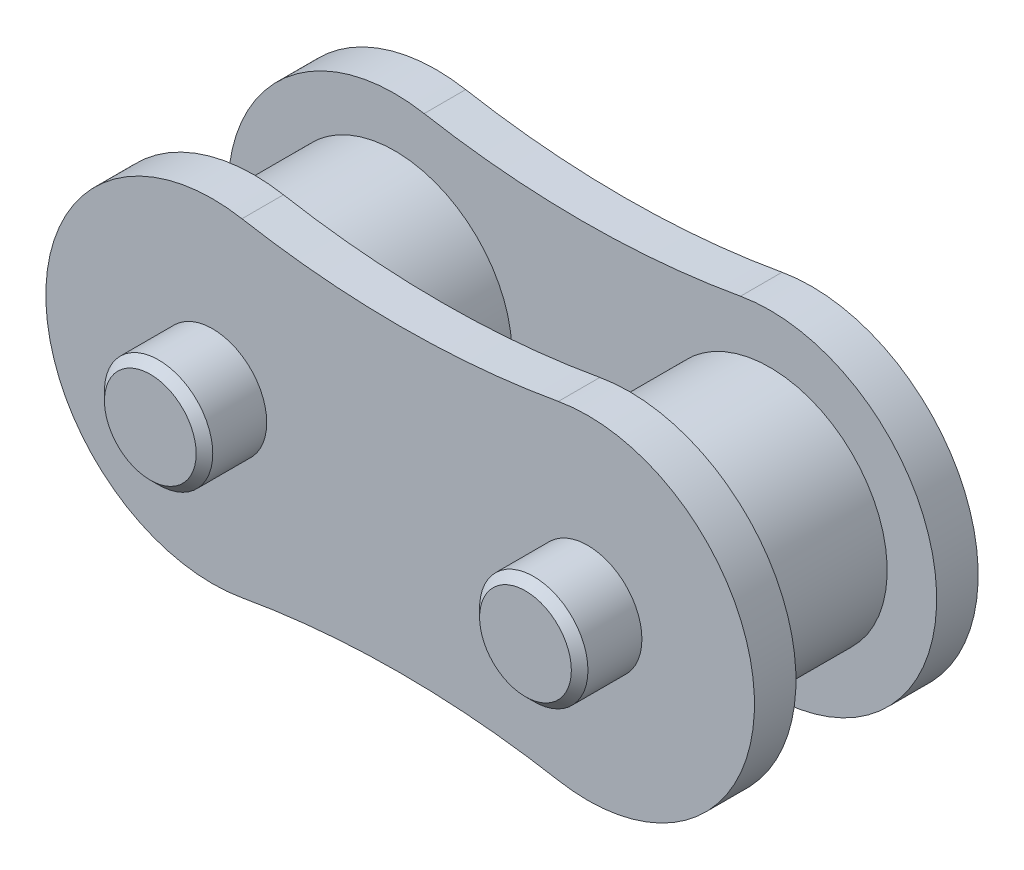
from build123d import *

# Parameters (mm, degrees)
SKETCH_2_R                 = 2.5
EXTRUDE_1_DEPTH            = 1.5
EXTRUDE_1_2_DEPTH          = 1.5
EXTRUDE_2_DEPTH            = 0.885
SKETCH_4_R                 = 1.155
EXTRUDE_3_DEPTH            = 1.3275
CHAMFER_1_SIZE             = 0.177
CHAMFER_1_OF_MIRROR_1_SIZE = 0.177


with BuildPart() as part:
    # 草图2 → 拉伸1 (new, symmetric)
    with BuildSketch(Plane.XY):
        with Locations((4, 0)):
            Circle(SKETCH_2_R)
    extrude(amount=EXTRUDE_1_DEPTH, both=True)



with BuildPart() as body_2:
    # 草图2 → Extrude 1 2 (new, symmetric)
    with BuildSketch(Plane.XY):
        with Locations((-4, 0)):
            Circle(SKETCH_2_R)
    extrude(amount=EXTRUDE_1_2_DEPTH, both=True)


with BuildPart() as part_1:
    add(part.part)

    add(body_2.part)  # 拉伸2 merges body 2
    # 草图3 → 拉伸2 (add)
    with BuildSketch(Plane.XY.offset(1.5)):
        with BuildLine():
            ThreePointArc((-3.373050874, 3.499279896), (-7.555, 0), (-3.373050874, -3.499279896))
            ThreePointArc((-3.373050874, -3.499279896), (0, -3.1995), (3.373050874, -3.499279896))
            ThreePointArc((3.373050874, -3.499279896), (7.555, 0), (3.373050874, 3.499279896))
            ThreePointArc((3.373050874, 3.499279896), (0, 3.1995), (-3.373050874, 3.499279896))
        make_face()
    extrude_2 = extrude(amount=EXTRUDE_2_DEPTH)

    # 草图4 → 拉伸3 (add)
    with BuildSketch(Plane.XY.offset(2.385)):
        with Locations((4, 0)):
            Circle(SKETCH_4_R)
        with Locations((-4, 0)):
            Circle(SKETCH_4_R)
    extrude_3 = extrude(amount=EXTRUDE_3_DEPTH)

    # 倒角1
    chamfer_1_edges = [part_1.edges().sort_by_distance(p)[0] for p in [
        (2.845, 0, 3.7125),
        (-5.155, 0, 3.7125),
    ]]
    chamfer(chamfer_1_edges, length=CHAMFER_1_SIZE)

    # 镜向1: 拉伸2, 拉伸3 across plane
    add(extrude_2.mirror(Plane.XY))
    add(extrude_3.mirror(Plane.XY))

    # 倒角1 of 镜向1
    chamfer_1_of_mirror_1_edges = [part_1.edges().sort_by_distance(p)[0] for p in [
        (2.845, 0, -3.7125),
        (-5.155, 0, -3.7125),
    ]]
    chamfer(chamfer_1_of_mirror_1_edges, length=CHAMFER_1_OF_MIRROR_1_SIZE)


solid = part_1.part
